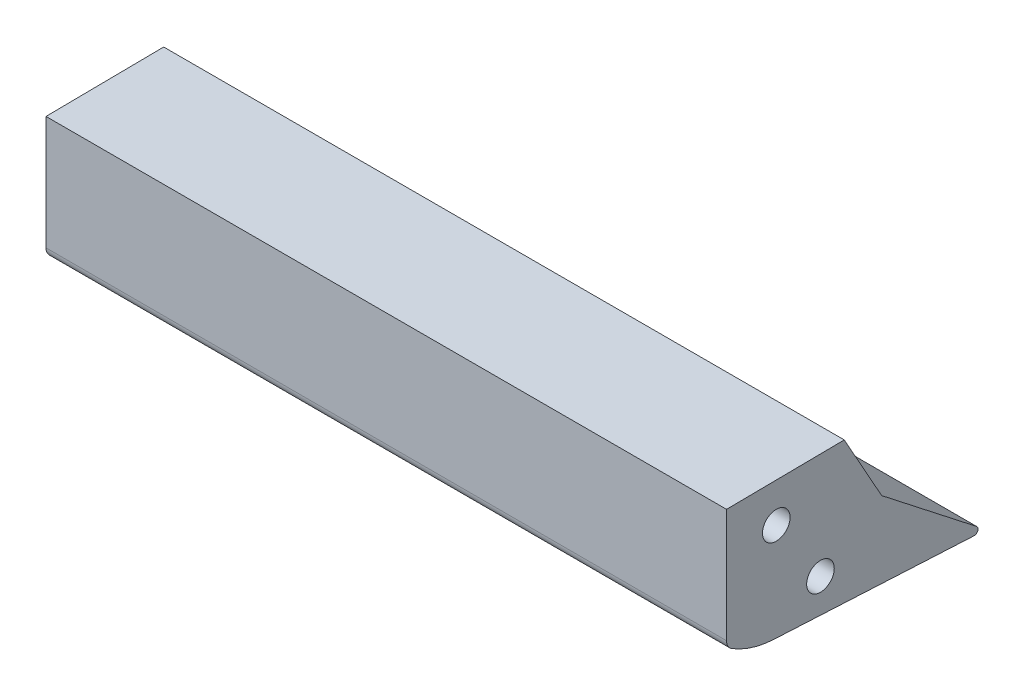
from build123d import *

# Parameters (mm, degrees)
SKETCH1_R               = 2.15
BOSS_EXTRUDE1_DEPTH     = 31.3
CUT_EXTRUDE1_REACH      = 48.052
SKETCH2_W               = 57.6
SKETCH2_H               = 12
CUT_EXTRUDE3_DEPTH      = 70.673542324
CUT_EXTRUDE4_DEPTH      = 41.650746822
CUT_EXTRUDE4_DEPTH_BACK = 41.650746822
SKETCH9_W               = 62.6
SKETCH9_H               = 53.637858301
SKETCH9_W_2             = 61.6
SKETCH9_H_2             = 51.637858301
SKETCH10_R              = 1.25
CUT_EXTRUDE5_DEPTH      = 12
CUT_EXTRUDE6_START      = -12
SKETCH11_R              = 1.25
CUT_EXTRUDE6_DEPTH      = 12
CORTE_EXTRUS_O1_DEPTH   = 69.776467632
FILETE1_R               = 1
FILETE2_R               = 0.35


with BuildPart() as part:
    # Sketch1 → Boss-Extrude1 (new, symmetric)
    with BuildSketch(Plane(origin=(0, 0, 0), x_dir=(0, 0, -1), z_dir=(1, 0, 0))):
        with BuildLine():
            Line((-4.25, 0), (-4.25, -4))
            ThreePointArc((-4.25, -4), (-4.121120876, -4.608298893), (-3.756629943, -5.112068414))
            Line((-3.756629943, -5.112068414), (-1.943370057, -6.753407807))
            ThreePointArc((-1.943370057, -6.753407807), (-1.578879124, -7.257177328), (-1.45, -7.865476221))
            Line((-1.45, -7.865476221), (-1.45, -21.2))
            Line((-1.45, -21.2), (22.05, -21.2))
            Line((22.05, -21.2), (12.593870957, -13.812062296))
            Line((12.593870957, -13.812062296), (3.709335443, 2.074447052))
            ThreePointArc((3.709335443, 2.074447052), (-1.071873212, 4.112613259), (-4.25, 0))
        make_face()
        Circle(SKETCH1_R, mode=Mode.SUBTRACT)
    extrude(amount=BOSS_EXTRUDE1_DEPTH, both=True)

    # Cut-Extrude1: up to this plane
    cut_extrude1_end = Plane(origin=(31.3, -13.812062296, -12.593870957), z_dir=(0, -0.4881051886126717, 0.8727848101619254))
    # Sketch2 → Cut-Extrude1 (cut, up to the surface)
    with BuildSketch(Plane.XY.offset(4.25), mode=Mode.PRIVATE) as cut_extrude1_sk1:
        with Locations((0, -1.75)):
            Rectangle(SKETCH2_W, SKETCH2_H)
    cut_extrude1_tool1 = split(extrude(cut_extrude1_sk1.sketch, amount=-CUT_EXTRUDE1_REACH, mode=Mode.PRIVATE), bisect_by=cut_extrude1_end, keep=Keep.BOTH, mode=Mode.PRIVATE)
    add(cut_extrude1_tool1.solids().sort_by_distance((0, -1.75, 4.25))[0], mode=Mode.SUBTRACT)

    # Sketch8 → Cut-Extrude3 (cut, through all)
    with BuildSketch(Plane(origin=(31.3, 0, 0), x_dir=(0, 0, -1), z_dir=(1, 0, 0))):
        with BuildLine():
            Line((-1.45, -7.865476221), (9.203660648, -7.75))
            Line((9.203660648, -7.75), (3.709335443, 2.074447052))
            ThreePointArc((3.709335443, 2.074447052), (-1.071873212, 4.112613259), (-4.25, 0))
            Line((-4.25, 0), (-4.25, -4))
            ThreePointArc((-4.25, -4), (-4.121120876, -4.608298893), (-3.756629943, -5.112068414))
            Line((-3.756629943, -5.112068414), (-1.943370057, -6.753407807))
            ThreePointArc((-1.943370057, -6.753407807), (-1.578879124, -7.257177328), (-1.45, -7.865476221))
        make_face()
    extrude(amount=-CUT_EXTRUDE3_DEPTH, mode=Mode.SUBTRACT)

    # Sketch9 → Cut-Extrude4 (cut, two sides: drawn at the far end of the back side and taken through both)
    with BuildSketch(Plane(origin=(0, -7.851819352, 0.190038007), x_dir=(1, 0, 0), z_dir=(0, 0.9999412620012955, 0.010838475319740372)).offset(-CUT_EXTRUDE4_DEPTH_BACK)):
        with Locations((0, 0.275128594)):
            Rectangle(SKETCH9_W, SKETCH9_H)
        with Locations((0, 0.275128594)):
            Rectangle(SKETCH9_W_2, SKETCH9_H_2, mode=Mode.SUBTRACT)
    extrude(amount=CUT_EXTRUDE4_DEPTH + CUT_EXTRUDE4_DEPTH_BACK, mode=Mode.SUBTRACT)

    # Sketch10 → Cut-Extrude5 (cut)
    with BuildSketch(Plane(origin=(30.8, 0, 0), x_dir=(0, 0, -1), z_dir=(1, 0, 0))):
        with Locations(Location((3.05, -11.365476221, 0), (0, 0, 90))):
            Circle(SKETCH10_R)
        with Locations(Location((7.05, -17.365476221, 0), (0, 0, 90))):
            Circle(SKETCH10_R)
    extrude(amount=-CUT_EXTRUDE5_DEPTH, mode=Mode.SUBTRACT)

    # Sketch11 → Cut-Extrude6 (cut)
    with BuildSketch(Plane.ZY.offset(30.8).offset(CUT_EXTRUDE6_START)):
        with Locations(Location((-7.05, -17.365476221, 0), (0, 0, 90))):
            Circle(SKETCH11_R)
        with Locations(Location((-3.05, -11.365476221, 0), (0, 0, 90))):
            Circle(SKETCH11_R)
    extrude(amount=CUT_EXTRUDE6_DEPTH, mode=Mode.SUBTRACT)

    # Esboço1 → Corte-extrusão1 (cut, through all)
    with BuildSketch(Plane(origin=(30.8, 0, 0), x_dir=(0, 0, -1), z_dir=(1, 0, 0))):
        with BuildLine():
            Line((-1.45, -21.2), (22.05, -21.2))
            Line((22.05, -21.2), (2.813375457, -20.2))
            ThreePointArc((2.813375457, -20.2), (0.573558931, -19.757329107), (-1.45, -18.7))
            Line((-1.45, -18.7), (-1.45, -21.2))
        make_face()
    extrude(amount=-CORTE_EXTRUS_O1_DEPTH, mode=Mode.SUBTRACT)

    # Filete1
    filete1_edges = [part.edges().sort_by_distance(p)[0] for p in [
        (0, -18.7, 1.45),
    ]]
    fillet(filete1_edges, radius=FILETE1_R)

    # Filete2
    filete2_edges = [part.edges().sort_by_distance(p)[0] for p in [
        (0, -21.2, -22.05),
    ]]
    fillet(filete2_edges, radius=FILETE2_R)


solid = part.part
